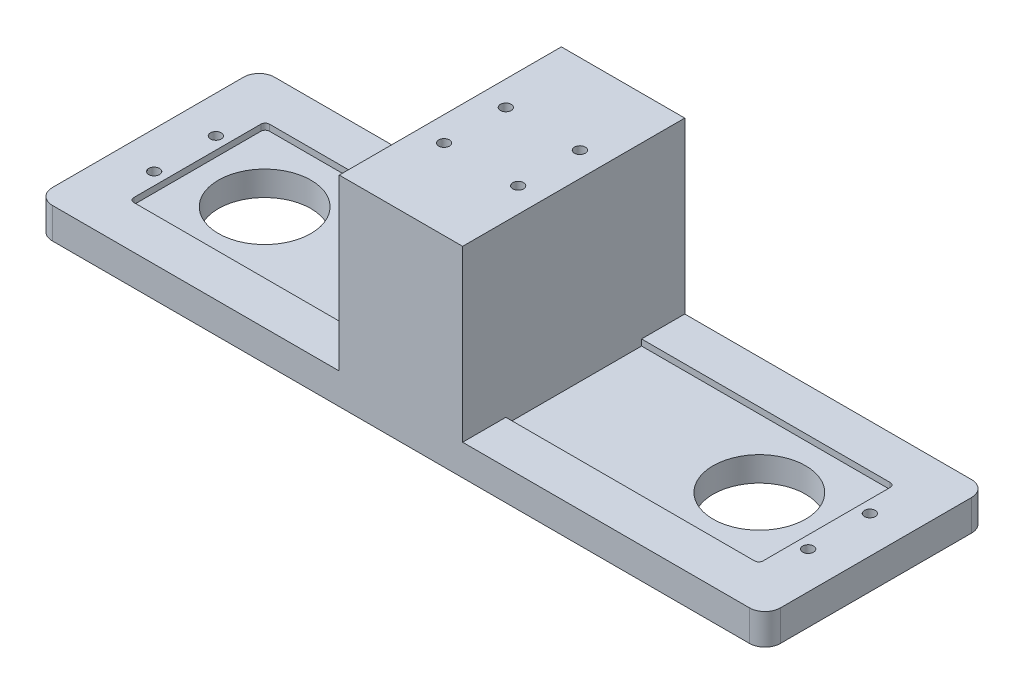
from build123d import *

# Parameters (mm, degrees)
SKETCH1_W            = 20
SKETCH1_H            = 36
BOSS_EXTRUDE1_DEPTH  = 4
SKETCH2_W            = 20
SKETCH2_H            = 36
BOSS_EXTRUDE2_DEPTH  = 28.5
BOSS_EXTRUDE3_DEPTH  = 1
FILLET1_R            = 0.7
FILLET3_R            = 0.7
FILLET3_OF_MIRROR3_R = 0.7
FILLET4_R            = 0.7
SKETCH14_R           = 0.875
CUT_EXTRUDE3_DEPTH   = 68.537026882
SKETCH16_R           = 7.5
CUT_EXTRUDE4_DEPTH   = 10
SKETCH18_R           = 0.875
CUT_EXTRUDE5_DEPTH   = 10


with BuildPart() as part:
    # Sketch1 → Boss-Extrude1 (new body)
    with BuildSketch(Plane(origin=(0, 0, 0), x_dir=(1, 0, 0), z_dir=(0, 1, 0))):
        with BuildLine():
            Line((-10, -18), (-10, 18))
            Line((-10, 18), (-56.5, 18))
            ThreePointArc((-56.5, 18), (-58.267766953, 17.267766953), (-59, 15.5))
            Line((-59, 15.5), (-59, -15.5))
            ThreePointArc((-59, -15.5), (-58.267766953, -17.267766953), (-56.5, -18))
            Line((-56.5, -18), (-10, -18))
        make_face()
        Rectangle(SKETCH1_W, SKETCH1_H)
        with BuildLine():
            ThreePointArc((59, 15.5), (58.267766953, 17.267766953), (56.5, 18))
            Line((56.5, 18), (10, 18))
            Line((10, 18), (10, -18))
            Line((10, -18), (56.5, -18))
            ThreePointArc((56.5, -18), (58.267766953, -17.267766953), (59, -15.5))
            Line((59, -15.5), (59, 15.5))
        make_face()
    extrude(amount=BOSS_EXTRUDE1_DEPTH)

    # Sketch2 → Boss-Extrude2 (add)
    with BuildSketch(Plane(origin=(0, 4, 0), x_dir=(1, 0, 0), z_dir=(0, 1, 0))):
        Rectangle(SKETCH2_W, SKETCH2_H)
    extrude(amount=BOSS_EXTRUDE2_DEPTH)

    # Sketch7 → Boss-Extrude3 (add)
    with BuildSketch(Plane(origin=(0, 4, 0), x_dir=(1, 0, 0), z_dir=(0, 1, 0))):
        with BuildLine():
            Line((-51, 11), (-10, 11))
            Line((-10, 11), (-10, 18))
            Line((-10, 18), (-56.5, 18))
            ThreePointArc((-56.5, 18), (-58.267766953, 17.267766953), (-59, 15.5))
            Line((-59, 15.5), (-59, -15.5))
            ThreePointArc((-59, -15.5), (-58.267766953, -17.267766953), (-56.5, -18))
            Line((-56.5, -18), (-10, -18))
            Line((-10, -18), (-10, -11))
            Line((-10, -11), (-51, -11))
            Line((-51, -11), (-51, 11))
        make_face()
    boss_extrude3 = extrude(amount=BOSS_EXTRUDE3_DEPTH)

    # Fillet1
    fillet1_edges = [part.edges().sort_by_distance(p)[0] for p in [
        (-51, 4.5, -11),
    ]]
    fillet(fillet1_edges, radius=FILLET1_R)

    # Fillet3
    fillet3_edges = [part.edges().sort_by_distance(p)[0] for p in [
        (-51, 4.5, 11),
    ]]
    fillet(fillet3_edges, radius=FILLET3_R)

    # Mirror3: Boss-Extrude3 across plane
    add(boss_extrude3.mirror(Plane(origin=(0, 0, 0), x_dir=(0, 0, 1), z_dir=(1, 0, 0))))

    # Fillet3 of Mirror3
    fillet3_of_mirror3_edges = [part.edges().sort_by_distance(p)[0] for p in [
        (51, 4.5, 11),
    ]]
    fillet(fillet3_of_mirror3_edges, radius=FILLET3_OF_MIRROR3_R)

    # Fillet4
    fillet4_edges = [part.edges().sort_by_distance(p)[0] for p in [
        (51, 4.5, -11),
    ]]
    fillet(fillet4_edges, radius=FILLET4_R)

    # Sketch14 → Cut-Extrude3 (cut, through all)
    with BuildSketch(Plane(origin=(0, 5, 0), x_dir=(1, 0, 0), z_dir=(0, 1, 0))):
        with Locations(Location((-53, -5, 0), (0, 0, 270))):
            Circle(SKETCH14_R)
        with Locations(Location((-53, 5, 0), (0, 0, 270))):
            Circle(SKETCH14_R)
        with Locations(Location((53, -5, 0), (0, 0, 90))):
            Circle(SKETCH14_R)
        with Locations(Location((53, 5, 0), (0, 0, 90))):
            Circle(SKETCH14_R)
    extrude(amount=-CUT_EXTRUDE3_DEPTH, mode=Mode.SUBTRACT)

    # Sketch16 → Cut-Extrude4 (cut)
    with BuildSketch(Plane.XZ):
        with Locations(Location((-40.09, 0, 0), (0, 0, 270))):
            Circle(SKETCH16_R)
    cut_extrude4 = extrude(amount=-CUT_EXTRUDE4_DEPTH, mode=Mode.SUBTRACT)

    # Mirror4: Cut-Extrude4 across plane
    add(cut_extrude4.mirror(Plane.ZY), mode=Mode.SUBTRACT)

    # Sketch18 → Cut-Extrude5 (cut)
    with BuildSketch(Plane(origin=(0, 32.5, 0), x_dir=(1, 0, 0), z_dir=(0, 1, 0))):
        with Locations(Location((-6, -5, 0), (0, 0, 270))):
            Circle(SKETCH18_R)
        with Locations(Location((-6, 5, 0), (0, 0, 270))):
            Circle(SKETCH18_R)
        with Locations(Location((6, 5, 0), (0, 0, 270))):
            Circle(SKETCH18_R)
        with Locations(Location((6, -5, 0), (0, 0, 270))):
            Circle(SKETCH18_R)
    extrude(amount=-CUT_EXTRUDE5_DEPTH, mode=Mode.SUBTRACT)


solid = part.part
